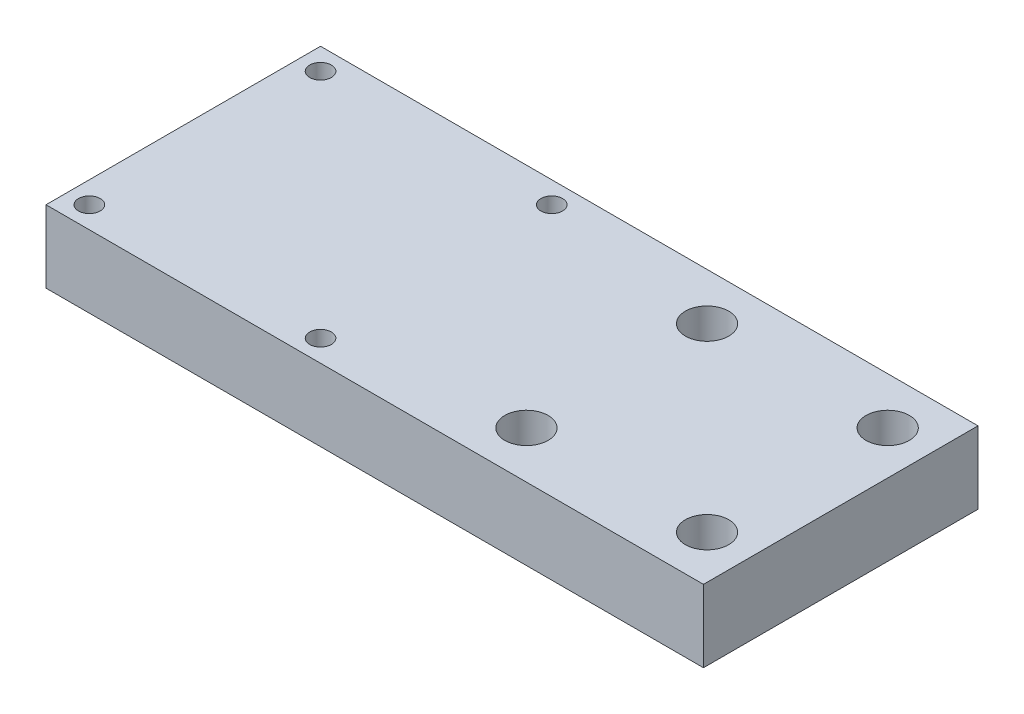
from build123d import *

# Parameters (mm, degrees)
SKETCH1_W           = 91
SKETCH1_H           = 38
SKETCH1_R           = 1.5
SKETCH1_R_2         = 3
BOSS_EXTRUDE1_DEPTH = 10


with BuildPart() as part:
    # Sketch1 → Boss-Extrude1 (new body)
    with BuildSketch(Plane(origin=(0, 0, 0), x_dir=(1, 0, 0), z_dir=(0, 1, 0))):
        with Locations((26.530497816, -16.359463259)):
            Rectangle(SKETCH1_W, SKETCH1_H)
        with Locations(Location((-15.969502184, -0.359463259, 0), (0, 0, 270))):
            Circle(SKETCH1_R, mode=Mode.SUBTRACT)
        with Locations(Location((16.030497816, -0.359463259, 0), (0, 0, 270))):
            Circle(SKETCH1_R, mode=Mode.SUBTRACT)
        with Locations(Location((16.030497816, -32.359463259, 0), (0, 0, 270))):
            Circle(SKETCH1_R, mode=Mode.SUBTRACT)
        with Locations(Location((-15.969502184, -32.359463259, 0), (0, 0, 270))):
            Circle(SKETCH1_R, mode=Mode.SUBTRACT)
        with Locations(Location((41.030497816, -28.859463259, 0), (0, 0, 270))):
            Circle(SKETCH1_R_2, mode=Mode.SUBTRACT)
        with Locations(Location((66.030497816, -28.859463259, 0), (0, 0, 270))):
            Circle(SKETCH1_R_2, mode=Mode.SUBTRACT)
        with Locations(Location((41.030497816, -3.859463259, 0), (0, 0, 270))):
            Circle(SKETCH1_R_2, mode=Mode.SUBTRACT)
        with Locations(Location((66.030497816, -3.859463259, 0), (0, 0, 270))):
            Circle(SKETCH1_R_2, mode=Mode.SUBTRACT)
    extrude(amount=BOSS_EXTRUDE1_DEPTH)


solid = part.part
